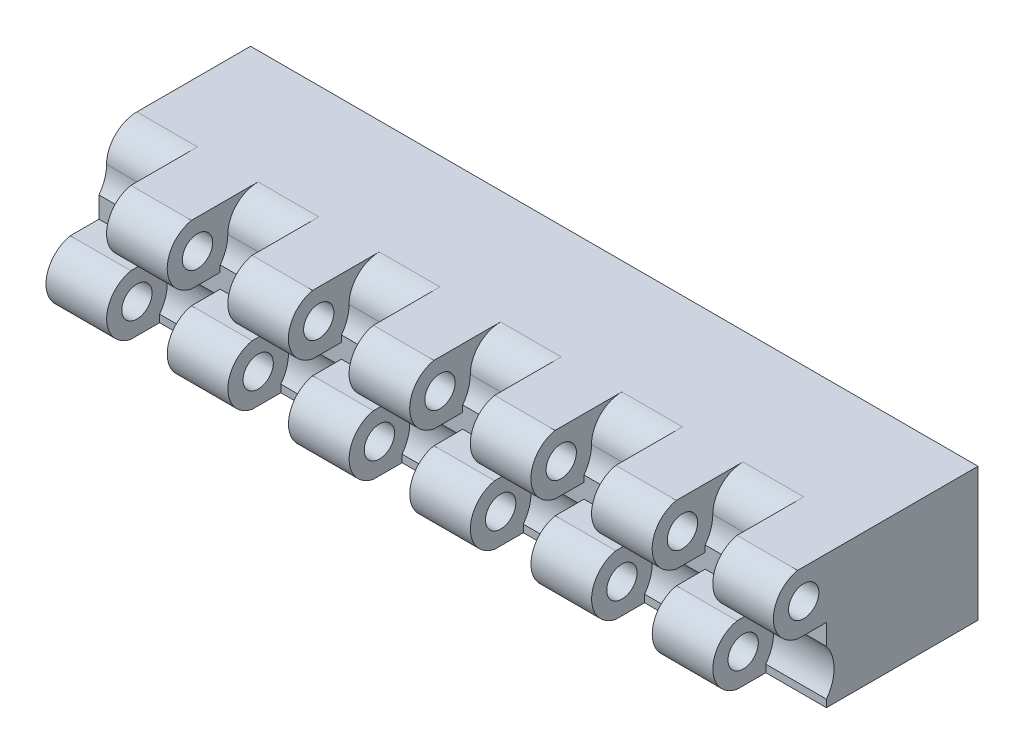
from build123d import *

# Parameters (mm, degrees)
SKETCH1_W           = 25
SKETCH1_H           = 22
BOSS_EXTRUDE1_DEPTH = 60
CUT_EXTRUDE2_REACH  = 123.15
CUT_EXTRUDE3_REACH  = 123.15
SKETCH6_R           = 6.26
FILLET1_R           = 5
SKETCH2_R           = 2.5
BOSS_EXTRUDE2_DEPTH = 10
LPATTERN1_COUNT     = 6
LPATTERN1_PITCH     = 20
SKETCH3_R           = 2.5
BOSS_EXTRUDE3_DEPTH = 10
LPATTERN2_COUNT     = 6
LPATTERN2_PITCH     = 20
SKETCH4_R           = 7
CUT_EXTRUDE1_DEPTH  = 15


with BuildPart() as part:
    # Sketch1 → Boss-Extrude1 (new, symmetric)
    with BuildSketch(Plane(origin=(0, 0, 0), x_dir=(0, 0, -1), z_dir=(1, 0, 0))):
        Rectangle(SKETCH1_W, SKETCH1_H)
    extrude(amount=BOSS_EXTRUDE1_DEPTH, both=True)

    # Sketch5 → Cut-Extrude2 (cut, up to next)
    with BuildSketch(Plane(origin=(60, 0, 0), x_dir=(0, 0, -1), z_dir=(1, 0, 0)), mode=Mode.PRIVATE) as cut_extrude2_sk1:
        with BuildLine():
            Line((-13.743342576, 11), (-11.25, 11))
            Line((-11.25, 11), (-11.25, 6.005))
            ThreePointArc((-11.25, 6.005), (-23.092030441, 3.213639122), (-13.743342576, 11))
        make_face()
    cut_extrude2_tool1 = extrude(cut_extrude2_sk1.sketch, amount=-CUT_EXTRUDE2_REACH, mode=Mode.PRIVATE) & part.part
    add(cut_extrude2_tool1.solids().sort_by_distance((60, 6.117758, 17.335764))[0], mode=Mode.SUBTRACT)

    # Sketch6 → Cut-Extrude3 (cut, up to next)
    with BuildSketch(Plane.ZY.offset(60), mode=Mode.PRIVATE) as cut_extrude3_sk1:
        with Locations((17.5, -6.005)):
            Circle(SKETCH6_R)
    cut_extrude3_tool1 = extrude(cut_extrude3_sk1.sketch, amount=-CUT_EXTRUDE3_REACH, mode=Mode.PRIVATE) & part.part
    add(cut_extrude3_tool1.solids().sort_by_distance((-60, -6.005, 17.5))[0], mode=Mode.SUBTRACT)

    # Fillet1
    fillet1_edges = [part.edges().sort_by_distance(p)[0] for p in [
        (0, 11, 11.25),
    ]]
    fillet(fillet1_edges, radius=FILLET1_R)

    # Sketch2 → Boss-Extrude2 (add)
    with BuildSketch(Plane(origin=(60, 0, 0), x_dir=(0, 0, -1), z_dir=(1, 0, 0))):
        with BuildLine():
            Line((-17.250000617, 1.202041029), (-6.000000617, 1.202041029))
            Line((-6.000000617, 1.202041029), (-6.000000617, 11))
            Line((-6.000000617, 11), (-17.250000617, 11))
            ThreePointArc((-17.250000617, 11), (-21.250000617, 6.101020514), (-17.250000617, 1.202041029))
        make_face()
        with Locations((-16.250000617, 6.101020514)):
            Circle(SKETCH2_R, mode=Mode.SUBTRACT)
    boss_extrude2 = extrude(amount=-BOSS_EXTRUDE2_DEPTH)

    # LPattern1: Boss-Extrude2 ×6
    with Locations(*[(-i * LPATTERN1_PITCH, 0, 0) for i in range(1, LPATTERN1_COUNT)]):
        add(boss_extrude2)

    # Sketch3 → Boss-Extrude3 (add)
    with BuildSketch(Plane.ZY.offset(60)):
        with BuildLine():
            Line((17.24, -1.202041029), (12.5, -1.202041029))
            Line((12.5, -1.202041029), (12.5, -2.238356932))
            ThreePointArc((12.5, -2.238356932), (11.24, -6.005), (12.5, -9.771643068))
            Line((12.5, -9.771643068), (12.5, -11))
            Line((12.5, -11), (17.24, -11))
            ThreePointArc((17.24, -11), (21.24, -6.101020514), (17.24, -1.202041029))
        make_face()
        with Locations((16.24, -6.101020514)):
            Circle(SKETCH3_R, mode=Mode.SUBTRACT)
    boss_extrude3 = extrude(amount=-BOSS_EXTRUDE3_DEPTH)

    # LPattern2: Boss-Extrude3 ×6
    with Locations(*[(i * LPATTERN2_PITCH, 0, 0) for i in range(1, LPATTERN2_COUNT)]):
        add(boss_extrude3)

    # Sketch4 → Cut-Extrude1 (cut)
    with BuildSketch(Plane(origin=(0, 0, -12.5), x_dir=(-1, 0, 0), z_dir=(0, 0, -1))):
        with Locations(Location((0, 0, 0), (0, 0, 90))):
            Circle(SKETCH4_R)
    extrude(amount=-CUT_EXTRUDE1_DEPTH, mode=Mode.SUBTRACT)


solid = part.part
